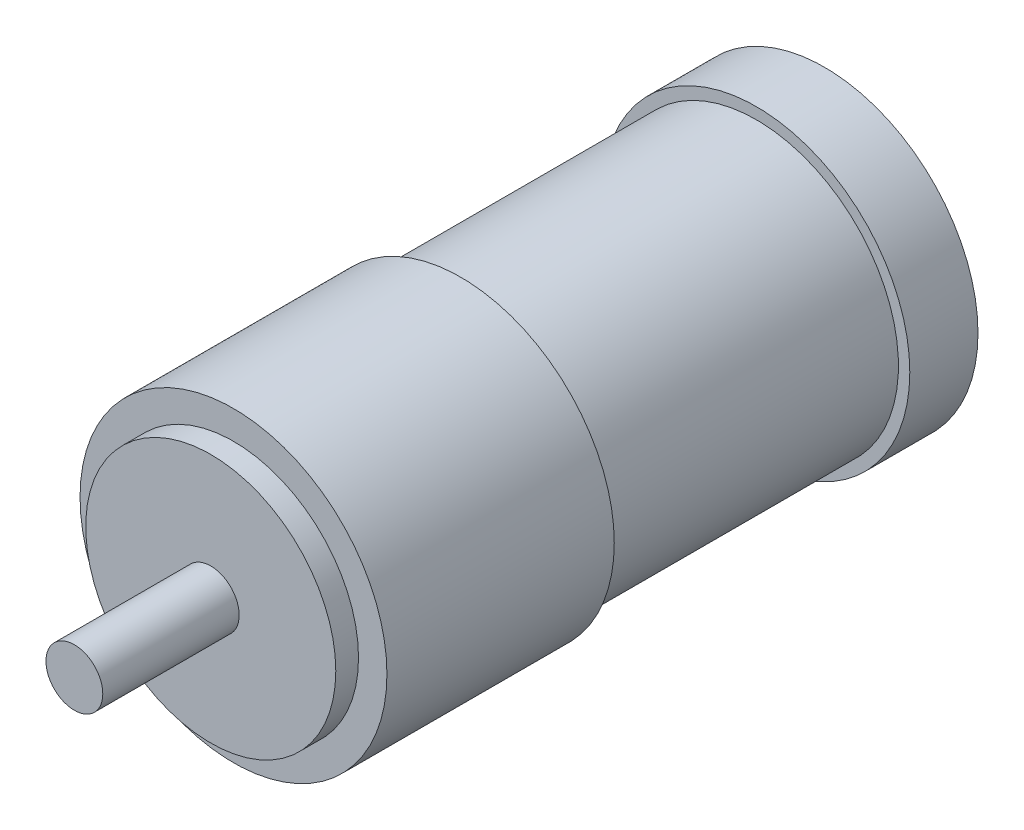
from build123d import *

# Parameters (mm, degrees)
SKETCH1_R           = 12.5
BOSS_EXTRUDE1_DEPTH = 52
SKETCH2_R           = 11
BOSS_EXTRUDE3_DEPTH = 2
SKETCH4_R           = 2.5
BOSS_EXTRUDE4_DEPTH = 12
BOSS_EXTRUDE5_START = -20
SKETCH5_R           = 13.5
BOSS_EXTRUDE5_DEPTH = 20
SKETCH6_R           = 13.5
BOSS_EXTRUDE6_DEPTH = 6
SKETCH8_R           = 9
BOSS_EXTRUDE7_DEPTH = 2
SKETCH9_R           = 12.5
CUT_EXTRUDE3_DEPTH  = 2


with BuildPart() as part:
    # Sketch1 → Boss-Extrude1 (new body)
    with BuildSketch(Plane.XY):
        with Locations(Location((0, 0, 0), (0, 0, 180))):
            Circle(SKETCH1_R)
    extrude(amount=BOSS_EXTRUDE1_DEPTH)

    # Sketch2 → Boss-Extrude3 (add)
    with BuildSketch(Plane.XY.offset(52)):
        Circle(SKETCH2_R)
    extrude(amount=BOSS_EXTRUDE3_DEPTH)

    # Sketch4 → Boss-Extrude4 (add)
    with BuildSketch(Plane.XY.offset(54)):
        Circle(SKETCH4_R)
    extrude(amount=BOSS_EXTRUDE4_DEPTH)

    # Sketch5 → Boss-Extrude5 (add)
    with BuildSketch(Plane.XY.offset(52).offset(BOSS_EXTRUDE5_START)):
        Circle(SKETCH5_R)
    extrude(amount=BOSS_EXTRUDE5_DEPTH)

    # Sketch6 → Boss-Extrude6 (add)
    with BuildSketch(Plane(origin=(0, 0, 0), x_dir=(-1, 0, 0), z_dir=(0, 0, -1))):
        with Locations(Location((0, 0, 0), (0, 0, 180))):
            Circle(SKETCH6_R)
    extrude(amount=-BOSS_EXTRUDE6_DEPTH)

    # Sketch8 → Boss-Extrude7 (add)
    with BuildSketch(Plane(origin=(0, 0, 0), x_dir=(-1, 0, 0), z_dir=(0, 0, -1))):
        Circle(SKETCH8_R)
    extrude(amount=BOSS_EXTRUDE7_DEPTH)

    # Sketch9 → Cut-Extrude3 (cut)
    with BuildSketch(Plane(origin=(0, 0, 0), x_dir=(-1, 0, 0), z_dir=(0, 0, -1))):
        Circle(SKETCH9_R)
    extrude(amount=-CUT_EXTRUDE3_DEPTH, mode=Mode.SUBTRACT)


with BuildPart() as cut_extrude3_piece_1:
    # of the separate pieces the step leaves, piece 1, a body of its own (cut_extrude3_pieces)
    add(part.part.solids().sort_by_distance((13.5, 0, 0))[0])


with BuildPart() as cut_extrude3_piece_2:
    # of the separate pieces the step leaves, piece 2, a body of its own (cut_extrude3_pieces)
    add(part.part.solids().sort_by_distance((-9, 0, 0))[0])


solid = Compound([cut_extrude3_piece_1.part, cut_extrude3_piece_2.part])
